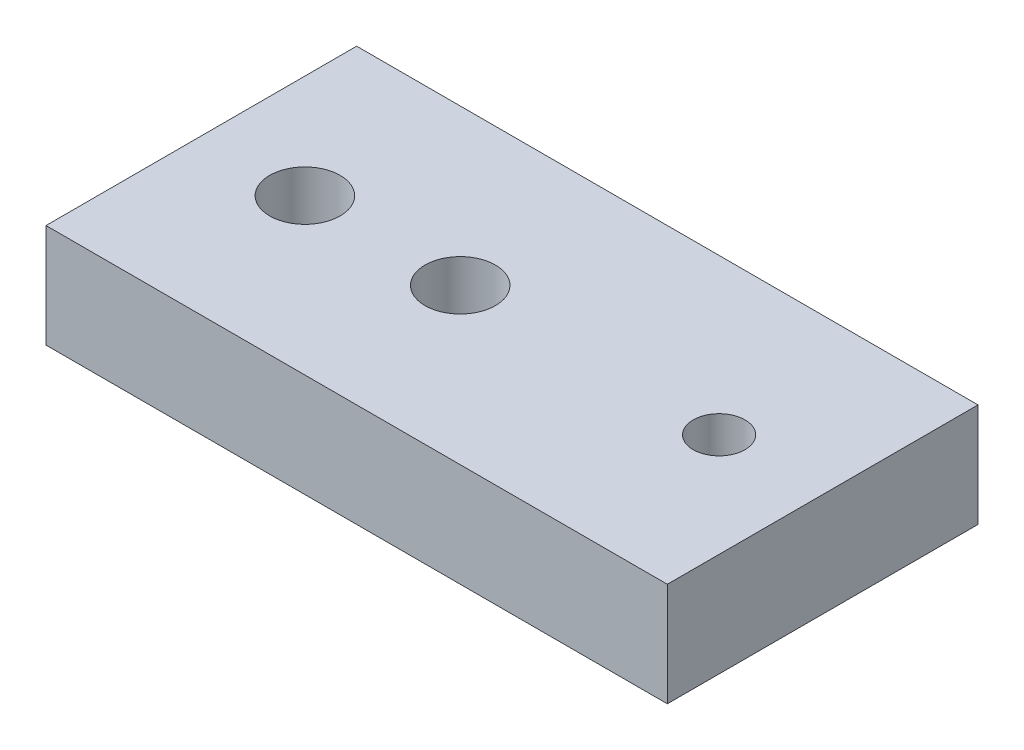
from build123d import *

# Parameters (mm, degrees)
SKETCH_1_W         = 60
SKETCH_1_H         = 30
EXTRUDE_1_DEPTH    = 10
MM_1_D             = 6.8
HOLE_WIZARD_M6_1_D = 5


with BuildPart() as part:
    # 草图1 → 凸台-拉伸1 (new body)
    with BuildSketch(Plane(origin=(0, 0, 0), x_dir=(1, 0, 0), z_dir=(0, 1, 0))):
        Rectangle(SKETCH_1_W, SKETCH_1_H)
    extrude(amount=EXTRUDE_1_DEPTH)

    # 大小mm 暗销孔1 (through all)
    with Locations(Plane(origin=(-20, 10, 0), x_dir=(0, 0, 1), z_dir=(0, 1, 0))):
        with Locations((0, 0), (0, 15)):
            Hole(MM_1_D / 2)

    # M6 螺纹孔1 (through all)
    with Locations(Plane(origin=(20, 10, 0), x_dir=(0, 0, 1), z_dir=(0, 1, 0))):
        with Locations((0, 0)):
            Hole(HOLE_WIZARD_M6_1_D / 2)


solid = part.part
